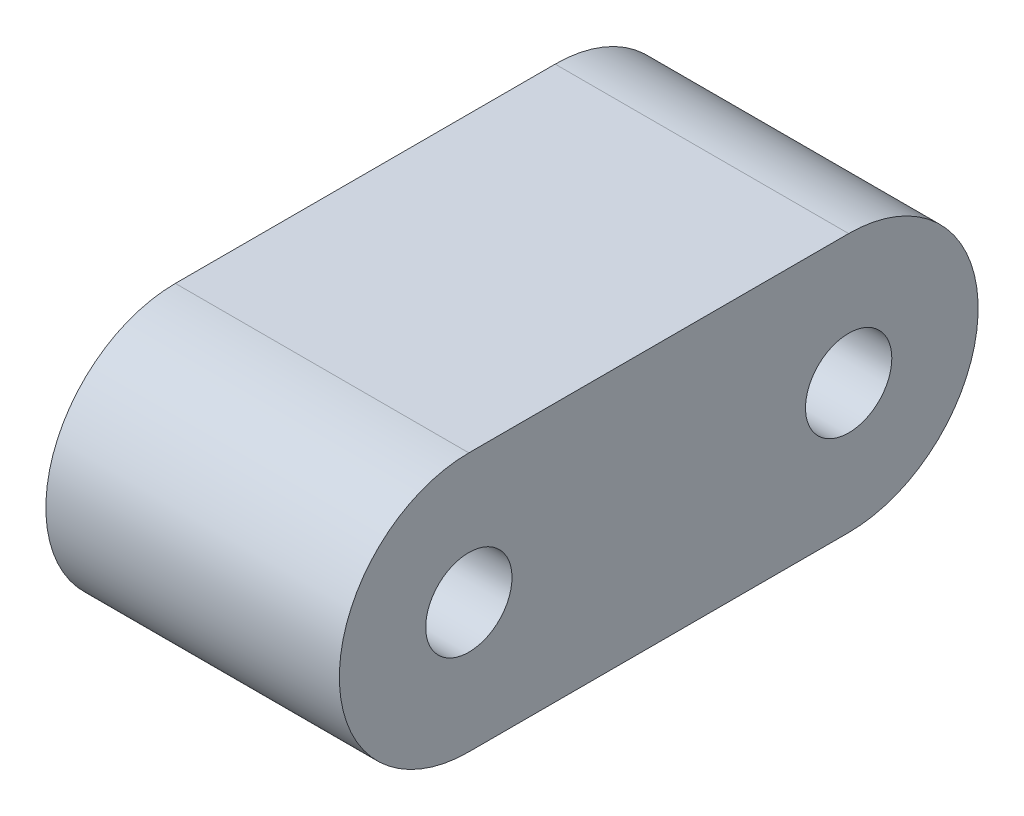
from build123d import *

# Parameters (mm, degrees)
CROQUIS1_R              = 2.5
SALIENTE_EXTRUIR1_DEPTH = 8.5


with BuildPart() as part:
    # Croquis1 → Saliente-Extruir1 (new, symmetric)
    with BuildSketch(Plane(origin=(0, 0, 0), x_dir=(0, 0, -1), z_dir=(1, 0, 0))):
        with BuildLine():
            Line((-11, 7.5), (11, 7.5))
            ThreePointArc((11, 7.5), (18.5, 0), (11, -7.5))
            Line((11, -7.5), (-11, -7.5))
            ThreePointArc((-11, -7.5), (-18.5, 0), (-11, 7.5))
        make_face()
        with Locations((-11, 0)):
            Circle(CROQUIS1_R, mode=Mode.SUBTRACT)
        with Locations((11, 0)):
            Circle(CROQUIS1_R, mode=Mode.SUBTRACT)
    extrude(amount=SALIENTE_EXTRUIR1_DEPTH, both=True)


solid = part.part
